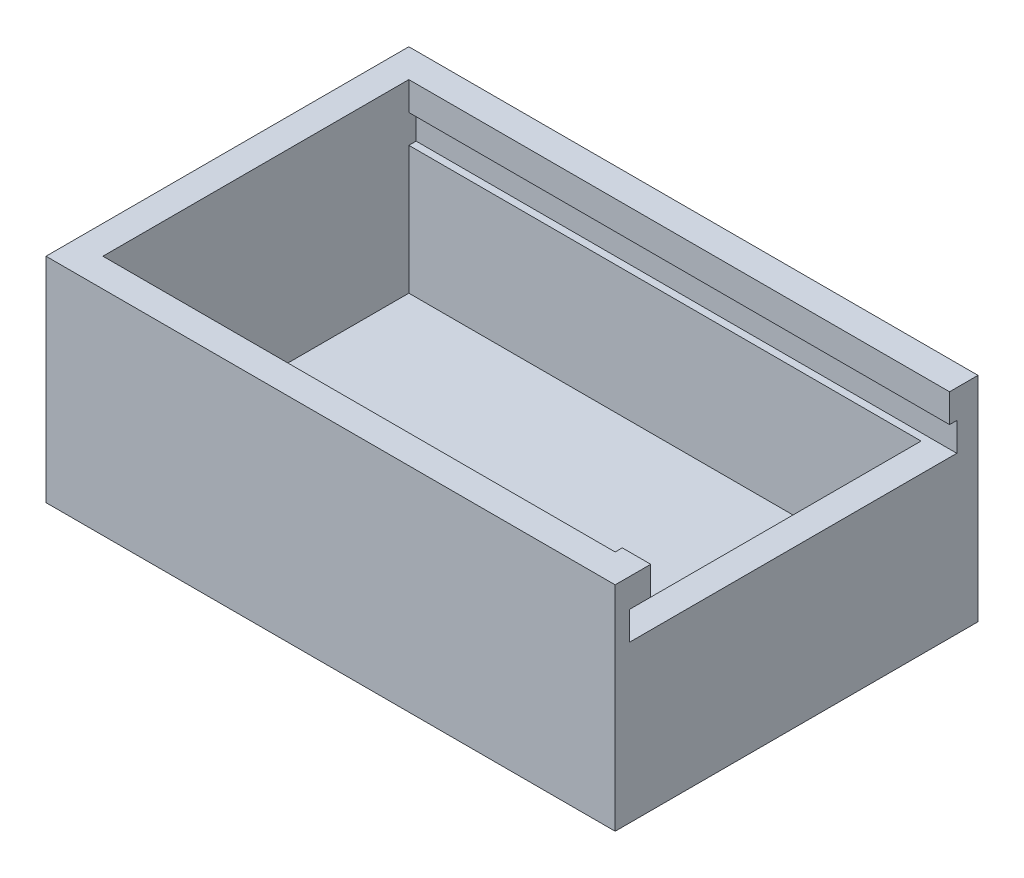
from build123d import *

# Parameters (mm, degrees)
SKETCH1_W           = 40
SKETCH1_H           = 25.5
BOSS_EXTRUDE1_DEPTH = 15
SHELL1_T            = -2
SKETCH2_W           = 21
SKETCH2_H           = 4
CUT_EXTRUDE1_DEPTH  = 2
SKETCH3_W           = 23.01
SKETCH3_H           = 2
CUT_EXTRUDE2_DEPTH  = 38


with BuildPart() as part:
    # Sketch1 → Boss-Extrude1 (new body)
    with BuildSketch(Plane(origin=(0, 0, 0), x_dir=(1, 0, 0), z_dir=(0, 1, 0))):
        Rectangle(SKETCH1_W, SKETCH1_H)
    extrude(amount=BOSS_EXTRUDE1_DEPTH)

    # Shell1
    shell1_openings = [part.faces().sort_by_distance(p)[0] for p in [
        (0, 15, 0),
    ]]
    offset(amount=SHELL1_T, openings=shell1_openings, kind=Kind.INTERSECTION)

    # Sketch2 → Cut-Extrude1 (cut)
    with BuildSketch(Plane(origin=(20, 0, 0), x_dir=(0, 0, -1), z_dir=(1, 0, 0))):
        with Locations((0.25, 13)):
            Rectangle(SKETCH2_W, SKETCH2_H)
    extrude(amount=-CUT_EXTRUDE1_DEPTH, mode=Mode.SUBTRACT)

    # Sketch3 → Cut-Extrude2 (cut)
    with BuildSketch(Plane(origin=(20, 0, 0), x_dir=(0, 0, -1), z_dir=(1, 0, 0))):
        with Locations((-0.245, 12)):
            Rectangle(SKETCH3_W, SKETCH3_H)
    extrude(amount=-CUT_EXTRUDE2_DEPTH, mode=Mode.SUBTRACT)


solid = part.part
